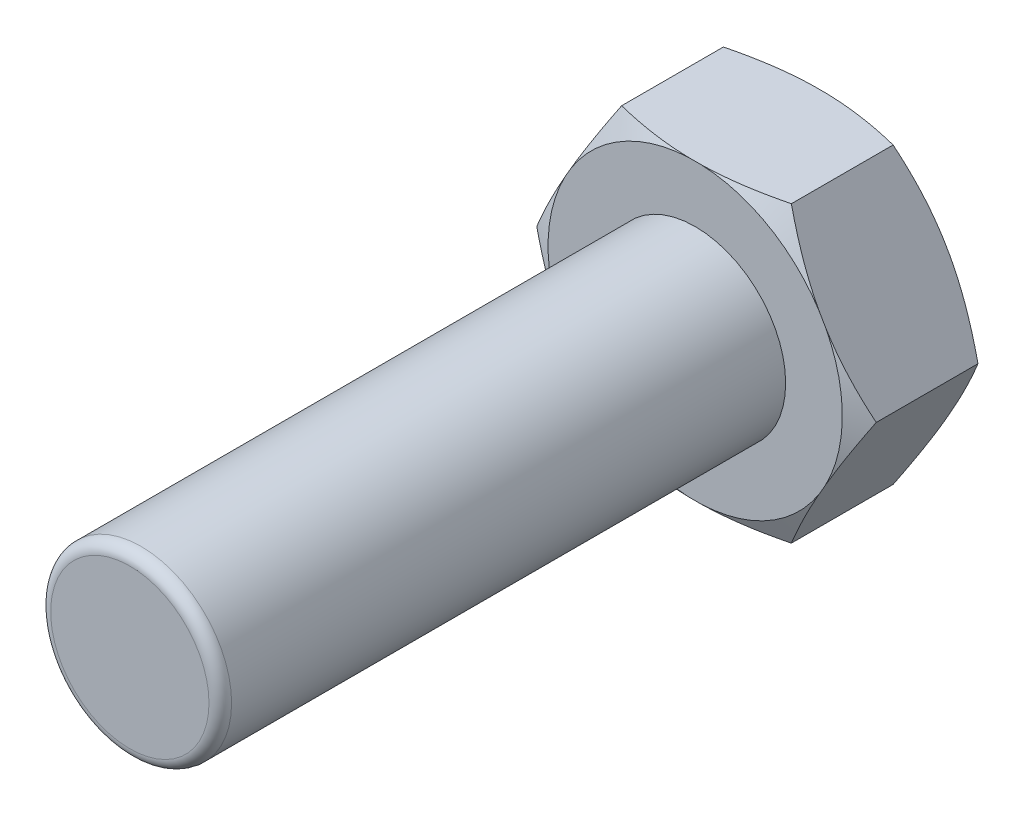
from build123d import *

# Parameters (mm, degrees)
Y_KSEKLIK_EKSTR_ZYON1_DEPTH = 5.5
IZIM2_R                     = 4
Y_KSEKLIK_EKSTR_ZYON2_DEPTH = 25
RADYUS1_R                   = 0.5


with BuildPart() as part:
    # Çizim1 → Yükseklik-Ekstrüzyon1 (new body)
    with BuildSketch(Plane.XY):
        Polygon((7.505553499, 0), (3.75277675, 6.5), (-3.75277675, 6.5), (-7.505553499, 0), (-3.75277675, -6.5), (3.75277675, -6.5), align=None)
    extrude(amount=Y_KSEKLIK_EKSTR_ZYON1_DEPTH)

    # Çizim2 → Yükseklik-Ekstrüzyon2 (add)
    with BuildSketch(Plane.XY.offset(5.5)):
        Circle(IZIM2_R)
    extrude(amount=Y_KSEKLIK_EKSTR_ZYON2_DEPTH)

    # Çizim3 → Kes-Döndür1 (revolve, cut)
    with BuildSketch(Plane(origin=(0, 0, 0), x_dir=(1, 0, 0), z_dir=(0, 1, 0))):
        Polygon((-7.505553499, 0), (-6.505553499, 0), (-7.505553499, -0.5), align=None)
        Polygon((-7.505553499, -5.5), (-7.505553499, -5), (-6.505553499, -5.5), align=None)
    revolve(axis=Axis((0, 0, 0), (0, 0, 1)), mode=Mode.SUBTRACT)

    # Radyus1
    radyus1_edges = [part.edges().sort_by_distance(p)[0] for p in [
        (-4, 0, 30.5),
    ]]
    fillet(radyus1_edges, radius=RADYUS1_R)


solid = part.part
